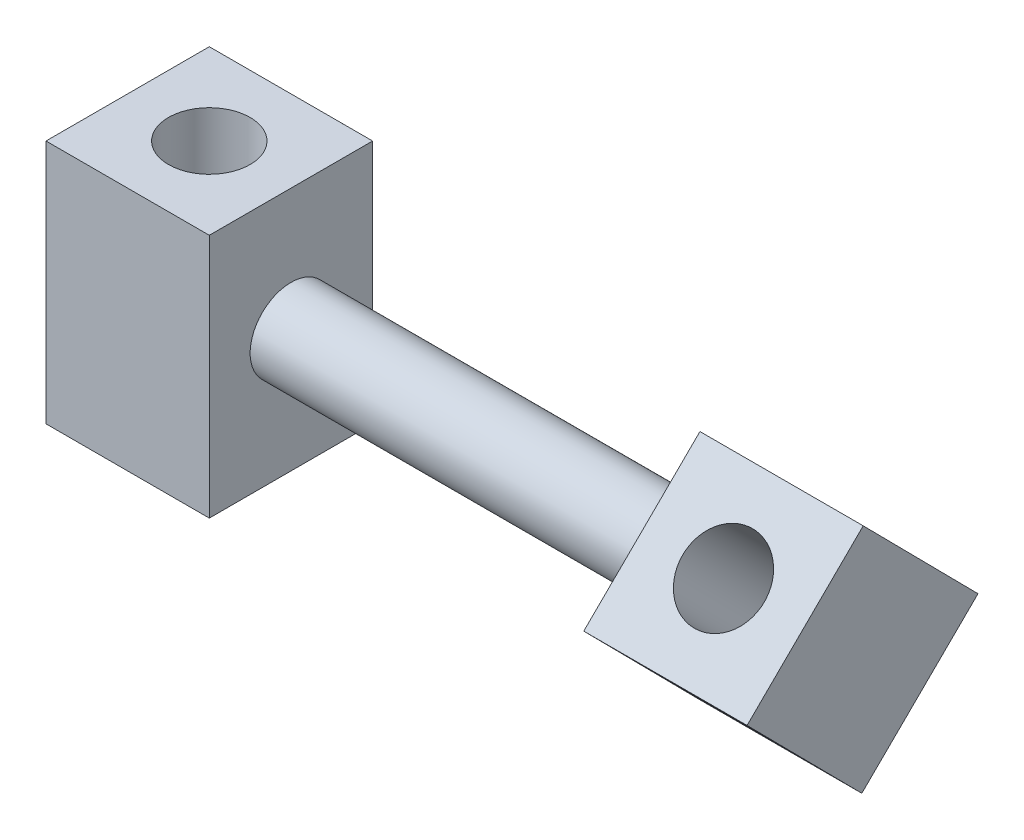
from build123d import *

# Parameters (mm, degrees)
SKETCH_1_W          = 20
SKETCH_1_H          = 20
EXTRUDE_1_DEPTH     = 30
SKETCH_2_R          = 5
EXTRUDE_2_DEPTH     = 50
EXTRUDE_3_DEPTH     = 20
CUT_EXTRUDE_1_REACH = 88.602
SKETCH_4_R          = 5
CUT_EXTRUDE_2_REACH = 88.348
SKETCH_5_R          = 5


with BuildPart() as part:
    # 草图1 → 凸台-拉伸1 (new body)
    with BuildSketch(Plane(origin=(0, 0, 0), x_dir=(1, 0, 0), z_dir=(0, 1, 0))):
        Rectangle(SKETCH_1_W, SKETCH_1_H)
    extrude(amount=EXTRUDE_1_DEPTH)

    # 草图2 → 凸台-拉伸2 (add)
    with BuildSketch(Plane(origin=(10, 0, 0), x_dir=(0, 0, -1), z_dir=(1, 0, 0))):
        with Locations((0, 15)):
            Circle(SKETCH_2_R)
    extrude(amount=EXTRUDE_2_DEPTH)

    # 草图3 → 凸台-拉伸3 (add)
    with BuildSketch(Plane(origin=(60, 0, 0), x_dir=(0, 0, -1), z_dir=(1, 0, 0))):
        Polygon((-14.14187695, 15.085535546), (0.085535546, 29.14187695), (14.14187695, 14.914464454), (-0.085535546, 0.85812305), align=None)
    extrude(amount=EXTRUDE_3_DEPTH)

    # 草图4 → 切除-拉伸1 (cut, up to next)
    with BuildSketch(Plane(origin=(0, 30, 0), x_dir=(1, 0, 0), z_dir=(0, 1, 0)), mode=Mode.PRIVATE) as cut_extrude_1_sk1:
        Circle(SKETCH_4_R)
    cut_extrude_1_tool1 = extrude(cut_extrude_1_sk1.sketch, amount=-CUT_EXTRUDE_1_REACH, mode=Mode.PRIVATE) & part.part
    add(cut_extrude_1_tool1.solids().sort_by_distance((0, 30, 0))[0], mode=Mode.SUBTRACT)

    # 草图5 → 切除-拉伸2 (cut, up to next)
    with BuildSketch(Plane(origin=(0, 14.704428736, 14.527621977), x_dir=(1, 0, 0), z_dir=(0, 0.7113706248059255, 0.7028170701990862)), mode=Mode.PRIVATE) as cut_extrude_2_sk1:
        with Locations((70, 10.542256053)):
            Circle(SKETCH_5_R)
    cut_extrude_2_tool1 = extrude(cut_extrude_2_sk1.sketch, amount=-CUT_EXTRUDE_2_REACH, mode=Mode.PRIVATE) & part.part
    add(cut_extrude_2_tool1.solids().sort_by_distance((70, 22.113706, 7.028171))[0], mode=Mode.SUBTRACT)


solid = part.part
